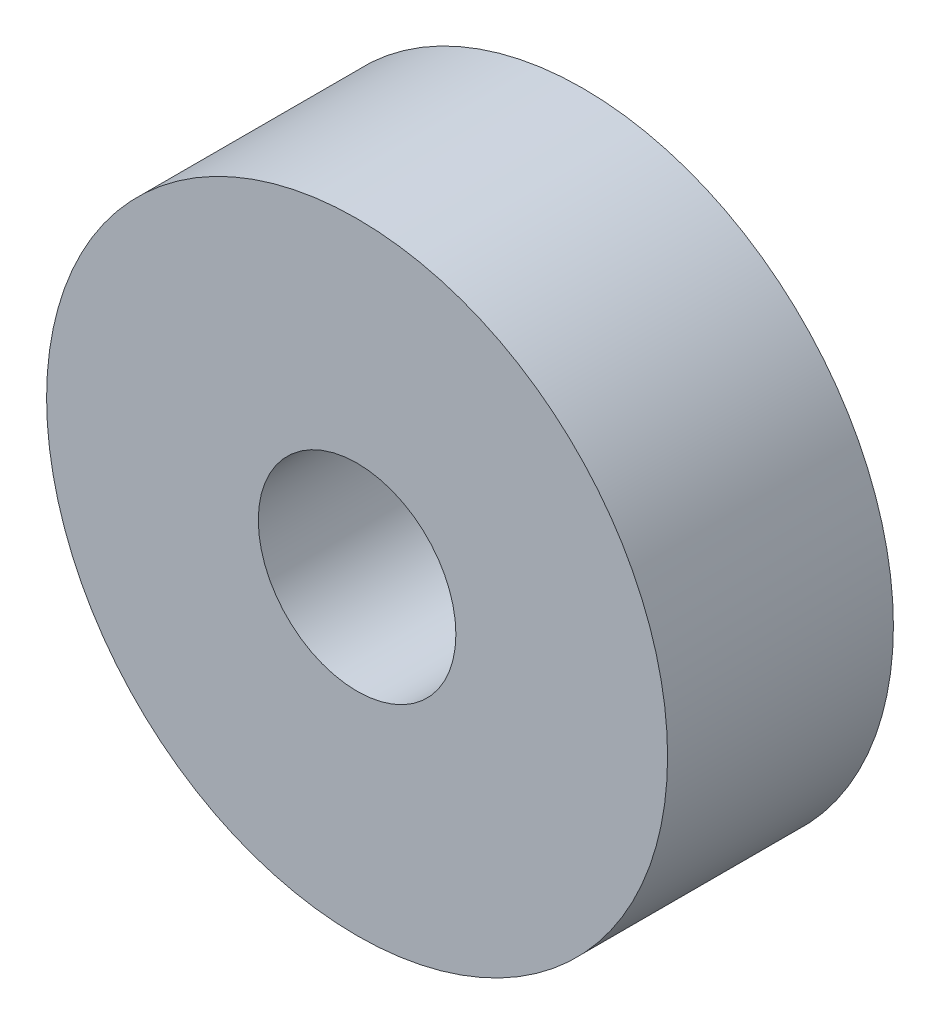
from build123d import *

# Parameters (mm, degrees)
SKETCH1_R           = 11
SKETCH1_R_2         = 3.5
BOSS_EXTRUDE1_DEPTH = 8


with BuildPart() as part:
    # Sketch1 → Boss-Extrude1 (new body)
    with BuildSketch(Plane.XY):
        with Locations((31.915591248, 315)):
            Circle(SKETCH1_R)
        with Locations((31.915591248, 315)):
            Circle(SKETCH1_R_2, mode=Mode.SUBTRACT)
    extrude(amount=BOSS_EXTRUDE1_DEPTH)


solid = part.part
